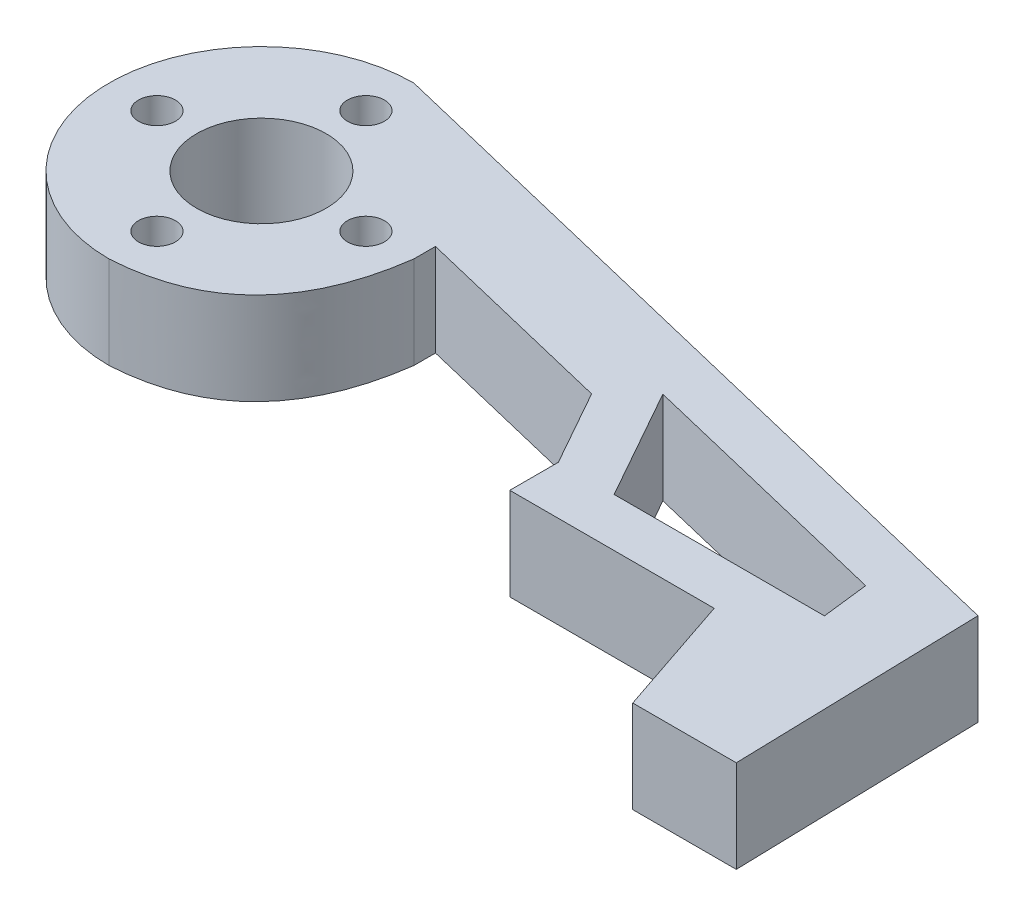
from build123d import *

# Parameters (mm, degrees)
SKETCH1_R           = 2
SKETCH1_R_2         = 7.01
BOSS_EXTRUDE1_DEPTH = 10
CUT_EXTRUDE1_DEPTH  = 10


with BuildPart() as part:
    # Sketch1 → Boss-Extrude1 (new body)
    # profile 1 of 2: a face of its own
    with BuildSketch(Plane(origin=(0, 0, 0), x_dir=(1, 0, 0), z_dir=(0, 1, 0))):
        with BuildLine():
            ThreePointArc((0, 16.5), (-16.5, 0), (0, -16.5))
            ThreePointArc((0, -16.5), (11.66726189, -11.66726189), (16.5, 0))
            ThreePointArc((16.5, 0), (14.076910684, 8.607588837), (7.519322958, 14.68706173))
            Line((7.519322958, 14.68706173), (0, 16.5))
        make_face()
        with Locations(Location((0, -11.314, 0), (0, 0, 270))):
            Circle(SKETCH1_R, mode=Mode.SUBTRACT)
        with Locations(Location((-11.314, 0, 0), (0, 0, 270))):
            Circle(SKETCH1_R, mode=Mode.SUBTRACT)
        with Locations(Location((0, 0, 0), (0, 0, 270))):
            Circle(SKETCH1_R_2, mode=Mode.SUBTRACT)
        with Locations(Location((11.314, 0, 0), (0, 0, 270))):
            Circle(SKETCH1_R, mode=Mode.SUBTRACT)
        with Locations(Location((0, 11.314, 0), (0, 0, 270))):
            Circle(SKETCH1_R, mode=Mode.SUBTRACT)
    # profile 2 of 2: a face of its own
    with BuildSketch(Plane(origin=(0, 0, 0), x_dir=(1, 0, 0), z_dir=(0, 1, 0))):
        with BuildLine():
            ThreePointArc((16.5, 0), (11.66726189, -11.66726189), (0, -16.5))
            Line((0, -16.5), (19.087841457, -16.5))
            Line((19.087841457, -16.5), (42.57033822, -16.5))
            Line((42.57033822, -16.5), (65.434874542, -16.5))
            Line((65.434874542, -16.5), (65.529162168, -16.5))
            Line((65.529162168, -16.5), (70, -29.789637879))
            Line((70, -29.789637879), (81.21126045, -29.789637879))
            Line((81.21126045, -29.789637879), (80.86351064, -16.5))
            Line((80.86351064, -16.5), (80.641091233, -8))
            Line((80.641091233, -8), (80.507921559, -2.910775794))
            Line((80.507921559, -2.910775794), (7.519322958, 14.68706173))
            ThreePointArc((7.519322958, 14.68706173), (14.076910684, 8.607588837), (16.5, 0))
        make_face()
    extrude(amount=BOSS_EXTRUDE1_DEPTH)

    # Sketch2 → Cut-Extrude1 (cut)
    with BuildSketch(Plane(origin=(0, 10, 0), x_dir=(1, 0, 0), z_dir=(0, 1, 0))):
        with BuildLine():
            add(Edge.make_bspline(
                [(0, -16.5), (14.394754893, -15.656765563), (16.5, 0)],
                knots=[0, 0, 0, 1, 1, 1], degree=2))
            Line((0, -16.5), (43.395579658, -16.5))
            Line((43.395579658, -16.5), (43.395579658, -11.239382549))
            Line((43.395579658, -11.239382549), (38.779311098, -3.023634866))
            Line((38.779311098, -3.023634866), (16.5, 2.347994462))
            Line((16.5, 2.347994462), (16.5, 0))
        make_face()
        Polygon((42.670487587, 0.800617581), (49.435529091, -11.239382549), (72.209122235, -11.239382549), (71.607948341, -6.176317755), align=None)
    extrude(amount=-CUT_EXTRUDE1_DEPTH, mode=Mode.SUBTRACT)


solid = part.part
